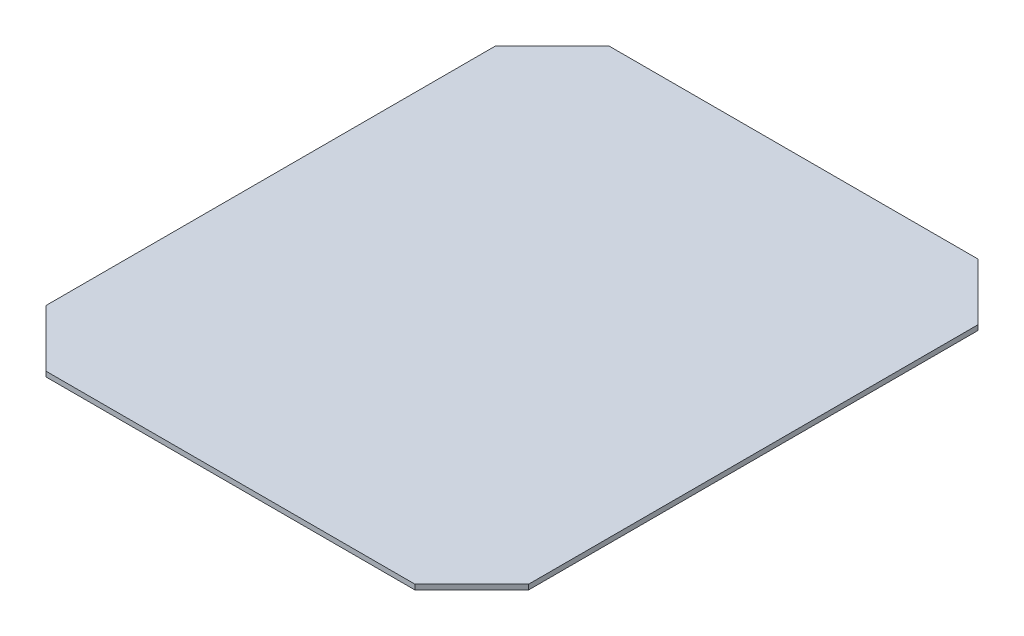
from build123d import *

# Parameters (mm, degrees)
BOSS_EXTRUDE1_DEPTH = 3.175


with BuildPart() as part:
    # Sketch1 → Boss-Extrude1 (new body)
    with BuildSketch(Plane(origin=(0, 0, 0), x_dir=(1, 0, 0), z_dir=(0, 1, 0))):
        Polygon((-25.845025354, 102.456360067), (-61.766049839, 66.535335583), (-61.766049839, -217.222615449), (-25.845025354, -253.143639933), (207.112925677, -253.143639933), (243.033950161, -217.222615449), (243.033950161, 66.535335583), (207.112925677, 102.456360067), align=None)
    extrude(amount=BOSS_EXTRUDE1_DEPTH)


solid = part.part
